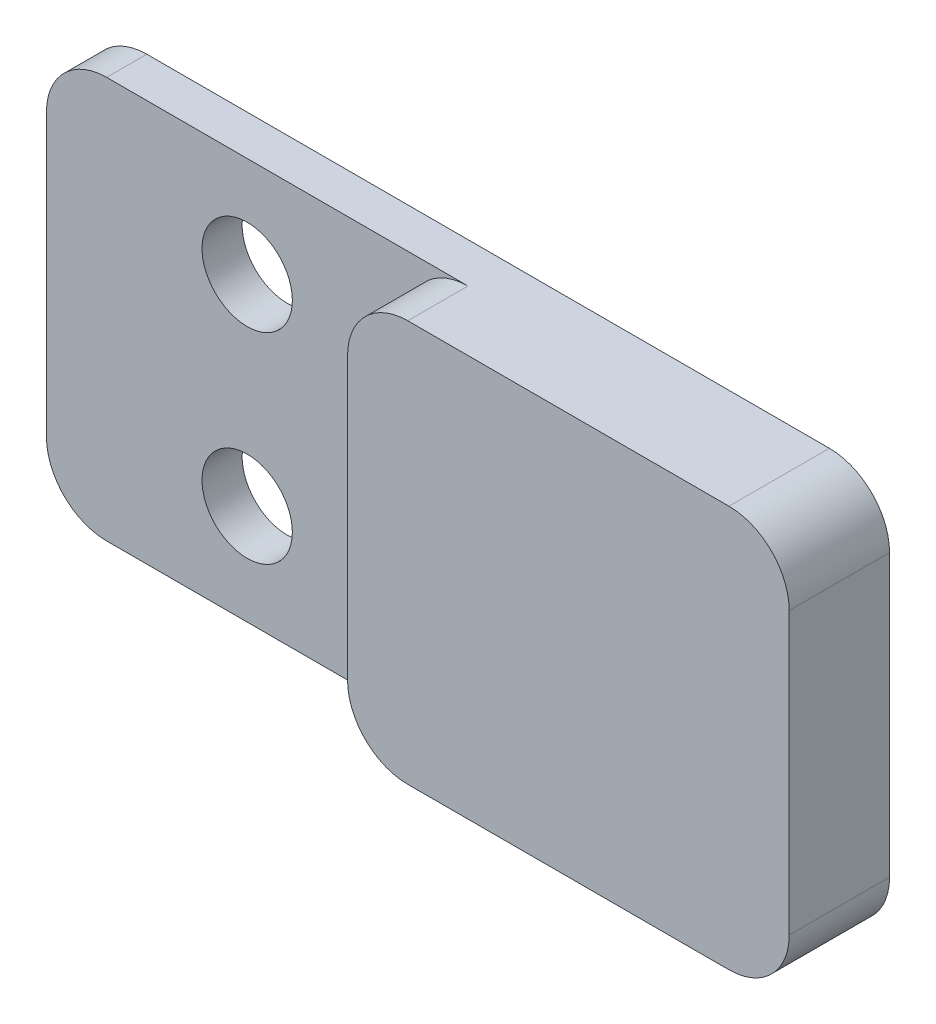
from build123d import *

# Parameters (mm, degrees)
SZKIC1_W                    = 40
SZKIC1_H                    = 20
SZKIC1_R                    = 2.25
DODANIE_WYCI_GNI_CIE1_DEPTH = 2
SZKIC3_W                    = 22
SZKIC3_H                    = 20
DODANIE_WYCI_GNI_CIE3_DEPTH = 3
ZAOKR_GLENIE1_R             = 3


with BuildPart() as part:
    # Szkic1 → Dodanie-wyciągnięcie1 (new body)
    with BuildSketch(Plane.XY):
        with Locations((0.494567618, 0.286392586)):
            Rectangle(SZKIC1_W, SZKIC1_H)
        with Locations((-9.505432382, 5.286392586)):
            Circle(SZKIC1_R, mode=Mode.SUBTRACT)
        with Locations((-9.505432382, -4.713607414)):
            Circle(SZKIC1_R, mode=Mode.SUBTRACT)
    extrude(amount=DODANIE_WYCI_GNI_CIE1_DEPTH)

    # Szkic3 → Dodanie-wyciągnięcie3 (add)
    with BuildSketch(Plane.XY.offset(2)):
        with Locations((9.494567618, 0.286392586)):
            Rectangle(SZKIC3_W, SZKIC3_H)
    extrude(amount=DODANIE_WYCI_GNI_CIE3_DEPTH)

    # Zaokrąglenie1
    zaokr_glenie1_edges = [part.edges().sort_by_distance(p)[0] for p in [
        (20.494567618, -9.713607414, 2.5),
        (-19.505432382, -9.713607414, 1),
        (-19.505432382, 10.286392586, 1),
        (20.494567618, 10.286392586, 2.5),
        (-1.505432382, 10.286392586, 3.5),
        (-1.505432382, -9.713607414, 3.5),
    ]]
    fillet(zaokr_glenie1_edges, radius=ZAOKR_GLENIE1_R)


solid = part.part
